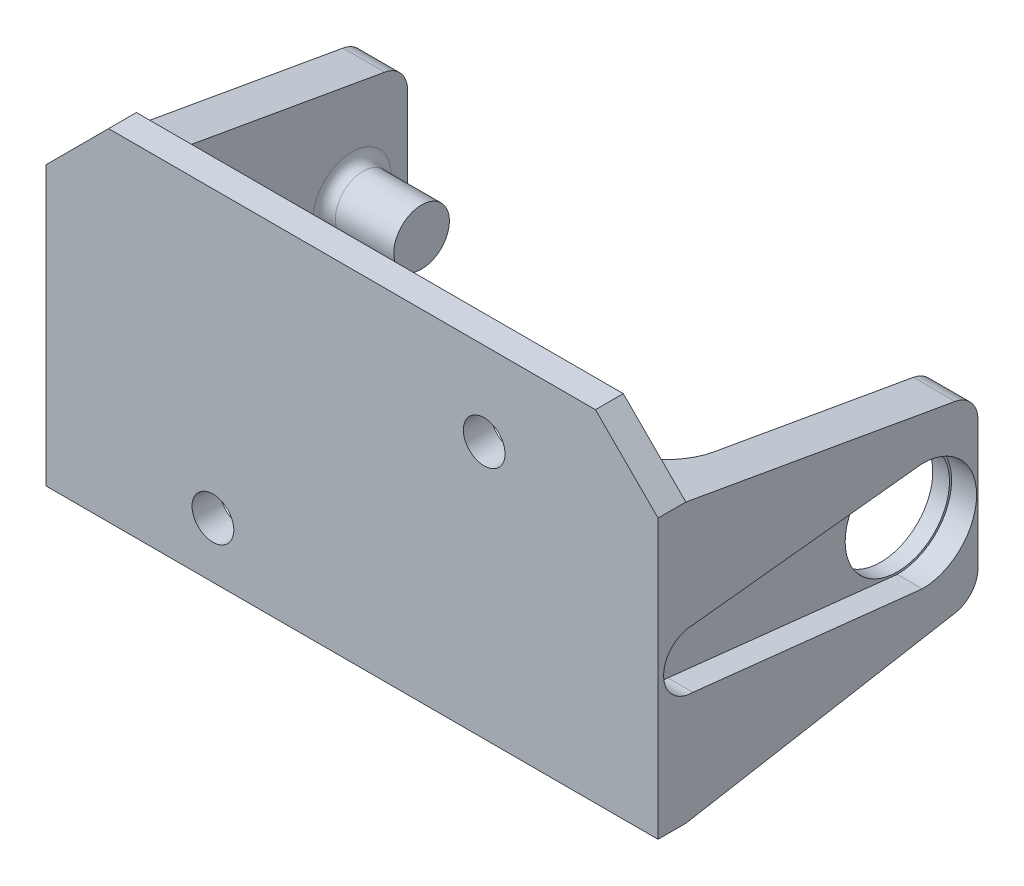
from build123d import *

# Parameters (mm, degrees)
SKETCH1_W           = 38
SKETCH1_H           = 20
BOSS_EXTRUDE1_DEPTH = 2
BOSS_EXTRUDE2_DEPTH = 3
BOSS_EXTRUDE3_DEPTH = 2
SKETCH4_R           = 1.6
CUT_EXTRUDE1_DEPTH  = 51.865017448
CUT_EXTRUDE2_START  = -1.2
CUT_EXTRUDE2_DEPTH  = 2
SKETCH6_R           = 3.75
CUT_EXTRUDE3_DEPTH  = 2.4
CUT_EXTRUDE4_DEPTH  = 34.693471178
SKETCH8_R           = 2
BOSS_EXTRUDE4_DEPTH = 8
FILLET1_R           = 0.8
FILLET2_R           = 5
SKETCH9_R           = 1.5
CUT_EXTRUDE5_DEPTH  = 10


with BuildPart() as part:
    # Sketch1 → Boss-Extrude1 (new body)
    with BuildSketch(Plane.XY):
        Rectangle(SKETCH1_W, SKETCH1_H)
    extrude(amount=BOSS_EXTRUDE1_DEPTH)

    # Sketch2 → Boss-Extrude2 (add)
    with BuildSketch(Plane(origin=(19, 0, 0), x_dir=(0, 0, -1), z_dir=(1, 0, 0))):
        with BuildLine():
            Line((-2, 10), (0, 10))
            Line((0, 10), (19.347296355, 6.588549649))
            ThreePointArc((19.347296355, 6.588549649), (20.532088886, 5.904509362), (21, 4.618934143))
            Line((21, 4.618934143), (21, -4.618934143))
            ThreePointArc((21, -4.618934143), (20.532088886, -5.904509362), (19.347296355, -6.588549649))
            Line((19.347296355, -6.588549649), (0, -10))
            Line((0, -10), (-2, -10))
            Line((-2, -10), (-2, 10))
        make_face()
    boss_extrude2 = extrude(amount=BOSS_EXTRUDE2_DEPTH)

    # Mirror1: Boss-Extrude2 across plane
    add(boss_extrude2.mirror(Plane(origin=(0, 0, 0), x_dir=(0, 0, 1), z_dir=(1, 0, 0))))

    # Sketch3 → Boss-Extrude3 (add)
    with BuildSketch(Plane(origin=(0, 0, 0), x_dir=(-1, 0, 0), z_dir=(0, 0, -1))):
        Polygon((-22, -10), (-17.5, -14.5), (17.5, -14.5), (22, -10), align=None)
        Polygon((-22, 10), (22, 10), (17.5, 14.5), (-17.5, 14.5), align=None)
    extrude(amount=-BOSS_EXTRUDE3_DEPTH)

    # Sketch4 → Cut-Extrude1 (cut, through all)
    with BuildSketch(Plane.ZY.offset(22)):
        with Locations((-17, 0)):
            Circle(SKETCH4_R)
    extrude(amount=-CUT_EXTRUDE1_DEPTH, mode=Mode.SUBTRACT)

    # Sketch5 → Cut-Extrude2 (cut)
    with BuildSketch(Plane.ZY.offset(-19).offset(CUT_EXTRUDE2_START)):
        with BuildLine():
            Line((-17, -3.9), (-0.5, -2.1))
            ThreePointArc((-0.5, -2.1), (1.6, 0), (-0.5, 2.1))
            Line((-0.5, 2.1), (-17, 3.9))
            ThreePointArc((-17, 3.9), (-20.9, 0), (-17, -3.9))
        make_face()
    extrude(amount=-CUT_EXTRUDE2_DEPTH, mode=Mode.SUBTRACT)

    # Sketch6 → Cut-Extrude3 (cut)
    with BuildSketch(Plane.ZY.offset(-19)):
        with Locations((-17, 0)):
            Circle(SKETCH6_R)
    extrude(amount=-CUT_EXTRUDE3_DEPTH, mode=Mode.SUBTRACT)

    # Sketch7 → Cut-Extrude4 (cut, through all)
    with BuildSketch(Plane(origin=(0, 0, 0), x_dir=(-1, 0, 0), z_dir=(0, 0, -1))):
        Polygon((17.5, -14.5), (22, -10), (19, -10), (-19, -10), (-22, -10), (-17.5, -14.5), align=None)
    extrude(amount=-CUT_EXTRUDE4_DEPTH, mode=Mode.SUBTRACT)

    # Sketch8 → Boss-Extrude4 (add)
    with BuildSketch(Plane.ZY.offset(22)):
        with Locations((-17, 0)):
            Circle(SKETCH8_R)
    extrude(amount=-BOSS_EXTRUDE4_DEPTH)

    # Fillet1
    fillet1_edges = [part.edges().sort_by_distance(p)[0] for p in [
        (-19, 0, -19),
    ]]
    fillet(fillet1_edges, radius=FILLET1_R)

    # Fillet2
    fillet2_edges = [part.edges().sort_by_distance(p)[0] for p in [
        (-19, 0, 0),
        (19, 0, 0),
    ]]
    fillet(fillet2_edges, radius=FILLET2_R)

    # Sketch9 → Cut-Extrude5 (cut)
    with BuildSketch(Plane(origin=(0, 0, 0), x_dir=(-1, 0, 0), z_dir=(0, 0, -1))):
        with Locations((-9.5, 8.5)):
            Circle(SKETCH9_R)
        with Locations((10, -6)):
            Circle(SKETCH9_R)
    extrude(amount=-CUT_EXTRUDE5_DEPTH, mode=Mode.SUBTRACT)


solid = part.part
